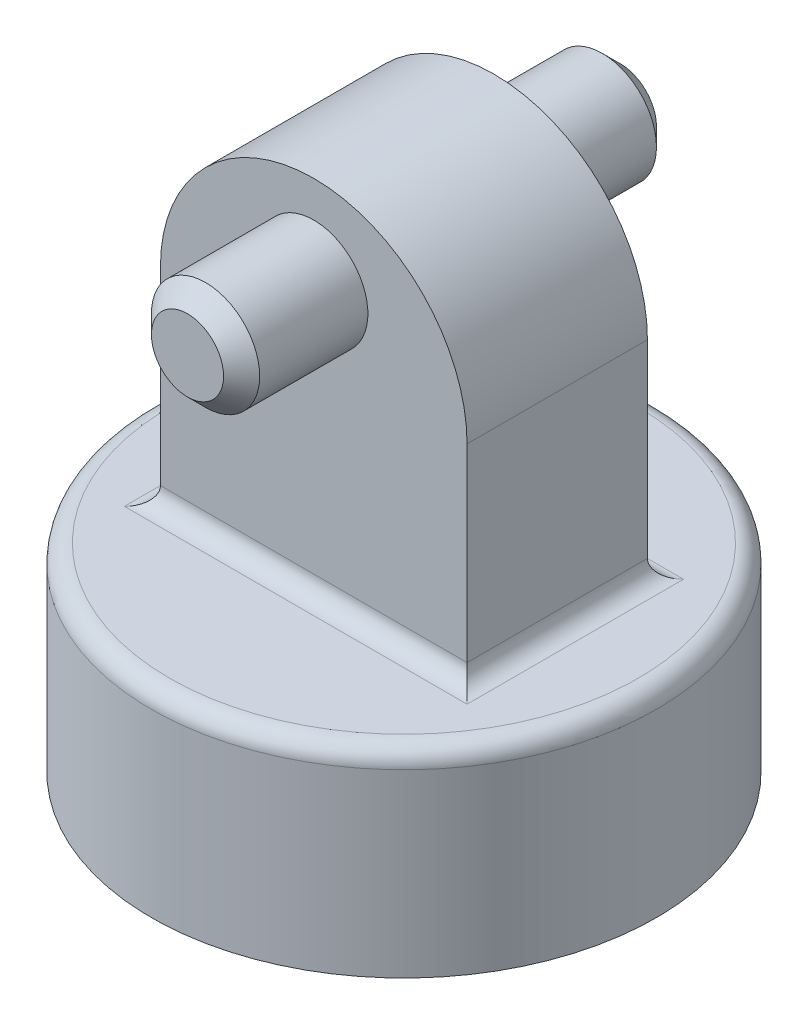
from build123d import *

# Parameters (mm, degrees)
CONG_1_R                = 1
ESQUISSE2_W             = 17
ESQUISSE2_H             = 10
BOSS_EXTRU_1_DEPTH      = 20
CONG_2_R                = 1
ENL_V_MAT_EXTRU_1_REACH = 40.962
ESQUISSE5_R             = 3
BOSS_EXTRU_2_DEPTH      = 7
CHANFREIN1_SIZE         = 1
CHANFREIN2_SIZE         = 1


with BuildPart() as part:
    # Esquisse1 → Révolution1 (revolve)
    with BuildSketch(Plane.XY, mode=Mode.PRIVATE) as r_volution1_sk:
        Polygon((-12, 0), (-12, 9), (0, 9), (0, 11), (-14, 11), (-14, 0), align=None)
    revolve(r_volution1_sk.sketch.rotate(Axis((0, 0, 0), (0, 1, 0)), 270), axis=Axis((0, 0, 0), (0, 1, 0)))

    # Congé1
    cong_1_edges = [part.edges().sort_by_distance(p)[0] for p in [
        (0, 11, 14),
    ]]
    fillet(cong_1_edges, radius=CONG_1_R)

    # Esquisse2 → Boss.-Extru.1 (add)
    with BuildSketch(Plane(origin=(0, 11, 0), x_dir=(1, 0, 0), z_dir=(0, 1, 0))):
        Rectangle(ESQUISSE2_W, ESQUISSE2_H)
    extrude(amount=BOSS_EXTRU_1_DEPTH)

    # Congé2
    cong_2_edges = [part.edges().sort_by_distance(p)[0] for p in [
        (8.5, 11, 0),
        (0, 11, -5),
        (-8.5, 11, 0),
        (0, 11, 5),
    ]]
    fillet(cong_2_edges, radius=CONG_2_R)

    # Esquisse3 → Enlèv. mat.-Extru.1 (cut, up to next)
    with BuildSketch(Plane.XY.offset(5), mode=Mode.PRIVATE) as enl_v_mat_extru_1_sk1:
        with BuildLine():
            ThreePointArc((-8.5, 22.5), (-6.010407626, 28.510407654), (4e-08, 31))
            Line((4e-08, 31), (-8.5, 31))
            Line((-8.5, 31), (-8.5, 22.5))
        make_face()
    enl_v_mat_extru_1_tool1 = extrude(enl_v_mat_extru_1_sk1.sketch, amount=-ENL_V_MAT_EXTRU_1_REACH, mode=Mode.PRIVATE) & part.part
    # Esquisse3 → Enlèv. mat.-Extru.1 (cut, up to next)
    with BuildSketch(Plane.XY.offset(5), mode=Mode.PRIVATE) as enl_v_mat_extru_1_sk2:
        with BuildLine():
            ThreePointArc((4e-08, 31), (6.010407654, 28.510407626), (8.5, 22.5))
            Line((8.5, 22.5), (8.5, 31))
            Line((8.5, 31), (4e-08, 31))
        make_face()
    enl_v_mat_extru_1_tool2 = extrude(enl_v_mat_extru_1_sk2.sketch, amount=-ENL_V_MAT_EXTRU_1_REACH, mode=Mode.PRIVATE) & part.part
    add(enl_v_mat_extru_1_tool1.solids().sort_by_distance((-6.601373, 29.101373, 5))[0], mode=Mode.SUBTRACT)
    add(enl_v_mat_extru_1_tool2.solids().sort_by_distance((6.601373, 29.101373, 5))[0], mode=Mode.SUBTRACT)

    # Esquisse5 → Boss.-Extru.2 (add)
    with BuildSketch(Plane.XY.offset(5)):
        with Locations(Location((0, 26, 0), (0, 0, 180))):
            Circle(ESQUISSE5_R)
    boss_extru_2 = extrude(amount=BOSS_EXTRU_2_DEPTH)

    # Chanfrein1
    chanfrein1_edges = [part.edges().sort_by_distance(p)[0] for p in [
        (3, 26, 12),
    ]]
    chamfer(chanfrein1_edges, length=CHANFREIN1_SIZE)

    # Symétrie4: Boss.-Extru.2 across plane
    add(boss_extru_2.mirror(Plane.XY))

    # Chanfrein2
    chanfrein2_edges = [part.edges().sort_by_distance(p)[0] for p in [
        (3, 26, -12),
    ]]
    chamfer(chanfrein2_edges, length=CHANFREIN2_SIZE)


solid = part.part
